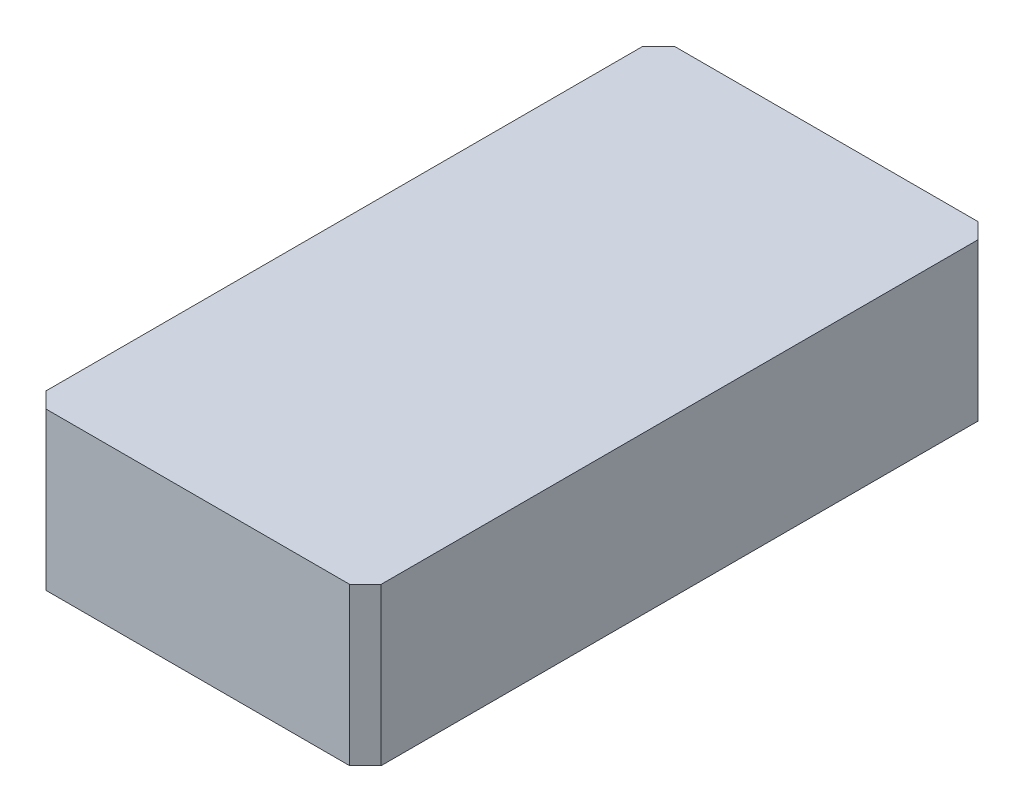
from build123d import *

# Parameters (mm, degrees)
EXTRUDE_1_DEPTH = 15


with BuildPart() as part:
    # 草图1 → 凸台-拉伸1 (new body)
    with BuildSketch(Plane(origin=(0, 0, 0), x_dir=(1, 0, 0), z_dir=(0, 1, 0))):
        Polygon((-14.5, -30), (14.5, -30), (16, -28.5), (16, 28.5), (14.5, 30), (-14.5, 30), (-16, 28.5), (-16, -28.5), align=None)
    extrude(amount=EXTRUDE_1_DEPTH)


solid = part.part
